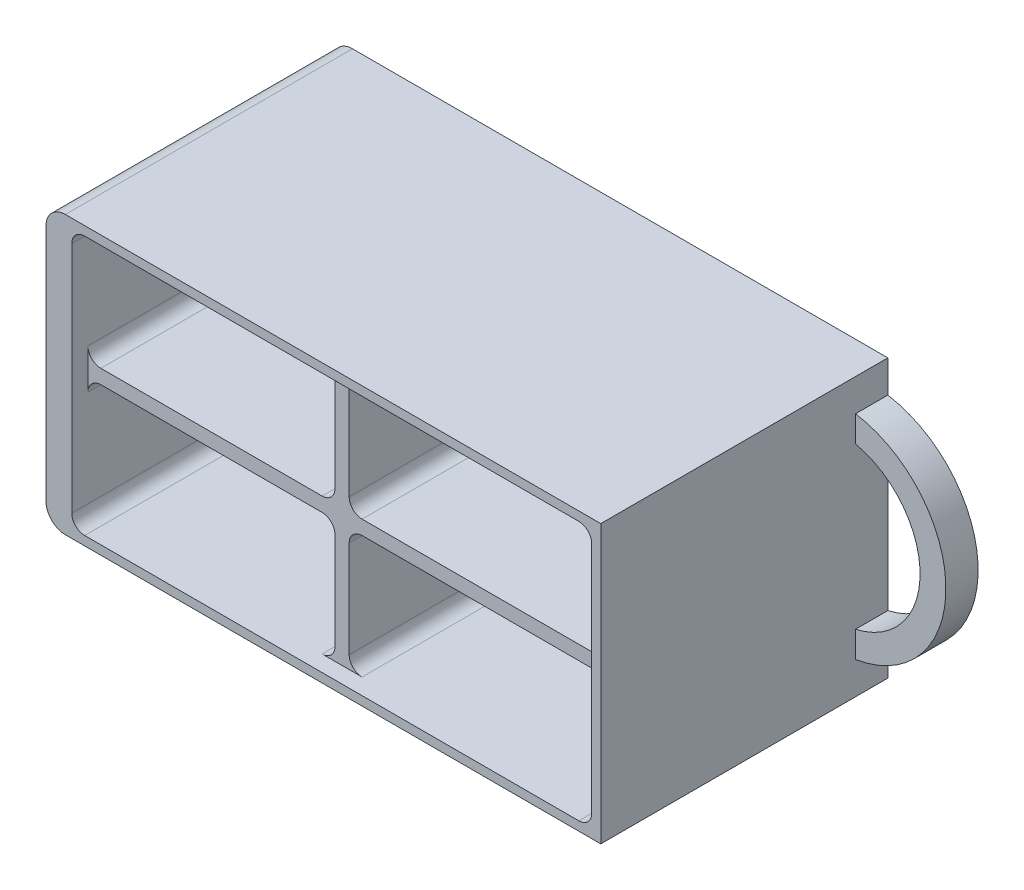
from build123d import *

# Parameters (mm, degrees)
SKETCH_1_W                  = 86
SKETCH_1_H                  = 43
EXTRUDE_1_DEPTH             = 39.5
EXTRUDE_2_DEPTH             = 5
SKETCH_3_W                  = 80.6
SKETCH_3_H                  = 40.2
CUT_EXTRUDE_1_DEPTH         = 43.6
HOLE_WIZARD_8_3_8_3_1_D     = 8.3
HOLE_WIZARD_8_3_8_3_1_DEPTH = 3.2
FILLET_1_R                  = 3
EXTRUDE_START               = -4
SKETCH_6_R                  = 4.15
EXTRUDE_3_DEPTH             = 4
EXTRUDE_4_DEPTH             = 42
SKETCH_10_W                 = 2.2
SKETCH_10_H                 = 43
EXTRUDE_5_DEPTH             = 42
FILLET_2_R                  = 2


with BuildPart() as part:
    # Эскиз1 → Бобышка-Вытянуть1 (new body)
    with BuildSketch(Plane.XY.offset(22.25)):
        with Locations((47, 0)):
            Rectangle(SKETCH_1_W, SKETCH_1_H)
    extrude(amount=-EXTRUDE_1_DEPTH)

    # Эскиз2 → Бобышка-Вытянуть2 (add)
    with BuildSketch(Plane(origin=(0, 0, -17.25), x_dir=(-1, 0, 0), z_dir=(0, 0, -1))):
        with BuildLine():
            Line((-90, -21.5), (-90, -16.5))
            ThreePointArc((-90, -16.5), (-104, 0), (-90, 16.5))
            Line((-90, 16.5), (-90, 21.5))
            Line((-90, 21.5), (-4, 21.5))
            Line((-4, 21.5), (-4, -21.5))
            Line((-4, -21.5), (-90, -21.5))
        make_face()
        with BuildLine():
            Line((-90, -12.428366172), (-90, 12.428366172))
            ThreePointArc((-90, 12.428366172), (-100, 0), (-90, -12.428366172))
        make_face(mode=Mode.SUBTRACT)
    extrude(amount=EXTRUDE_2_DEPTH)

    # Эскиз3 → Вырез-Вытянуть1 (cut)
    with BuildSketch(Plane.XY.offset(22.25)):
        with Locations((48.3, 0)):
            Rectangle(SKETCH_3_W, SKETCH_3_H)
    extrude(amount=-CUT_EXTRUDE_1_DEPTH, mode=Mode.SUBTRACT)

    # Диаметр отверстия Ø8.3 (8.3)1
    with Locations(Plane.ZY.offset(-4)):
        with Locations((0, 0)):
            Hole(HOLE_WIZARD_8_3_8_3_1_D / 2, depth=HOLE_WIZARD_8_3_8_3_1_DEPTH)

    # Скругление1
    fillet_1_edges = [part.edges().sort_by_distance(p)[0] for p in [
        (4, -21.5, 0),
        (4, 21.5, 0),
    ]]
    fillet(fillet_1_edges, radius=FILLET_1_R)

    # Эскиз6 → Бобышка-Вытянуть3 (add)
    with BuildSketch(Plane.ZY.offset(-4).offset(EXTRUDE_START)):
        Circle(SKETCH_6_R)
    extrude(amount=EXTRUDE_3_DEPTH)

    # Эскиз7 → Бобышка-Вытянуть4 (add)
    with BuildSketch(Plane(origin=(0, 0, -22.25), x_dir=(-1, 0, 0), z_dir=(0, 0, -1))):
        Polygon((-90, -1.1), (-90, 1.1), (-4, 1.1), (-4, 0), (-4, -1.1), align=None)
    extrude(amount=-EXTRUDE_4_DEPTH)

    # Эскиз10 → Бобышка-Вытянуть5 (add)
    with BuildSketch(Plane(origin=(0, 0, -22.25), x_dir=(-1, 0, 0), z_dir=(0, 0, -1))):
        with Locations((-47.4, 0)):
            Rectangle(SKETCH_10_W, SKETCH_10_H)
    extrude(amount=-EXTRUDE_5_DEPTH)

    # Скругление2
    fillet_2_edges = [part.edges().sort_by_distance(p)[0] for p in [
        (27.15, 1.1, -21.35),
        (48.5, 1.1, -0.8),
        (46.3, 1.1, -0.8),
        (68.55, -1.1, -21.35),
        (27.15, 20.1, -21.35),
        (68.55, -20.1, -21.35),
        (46.3, -1.1, -0.8),
        (46.3, -10.6, -21.35),
        (46.3, 10.6, -21.35),
        (48.5, -10.6, -21.35),
        (48.5, -1.1, -0.8),
        (48.5, 10.6, -21.35),
        (46.3, -20.1, -0.8),
        (46.3, 20.1, -0.8),
        (48.5, -20.1, -0.8),
        (48.5, 20.1, -0.8),
        (27.15, -20.1, -21.35),
        (88.6, -20.1, 0.45),
        (8, 10.6, -21.35),
        (8, -20.1, 0.45),
        (68.55, 20.1, -21.35),
        (8, 20.1, 0.45),
        (88.6, -10.6, -21.35),
        (88.6, 20.1, 0.45),
        (88.6, 10.6, -21.35),
        (8, -10.6, -21.35),
        (68.55, 1.1, -21.35),
        (27.15, -1.1, -21.35),
        (8, -1.1, -0.8),
        (88.6, -1.1, -0.8),
        (8, 1.1, -0.8),
        (88.6, 1.1, -0.8),
    ]]
    fillet(fillet_2_edges, radius=FILLET_2_R)


solid = part.part
